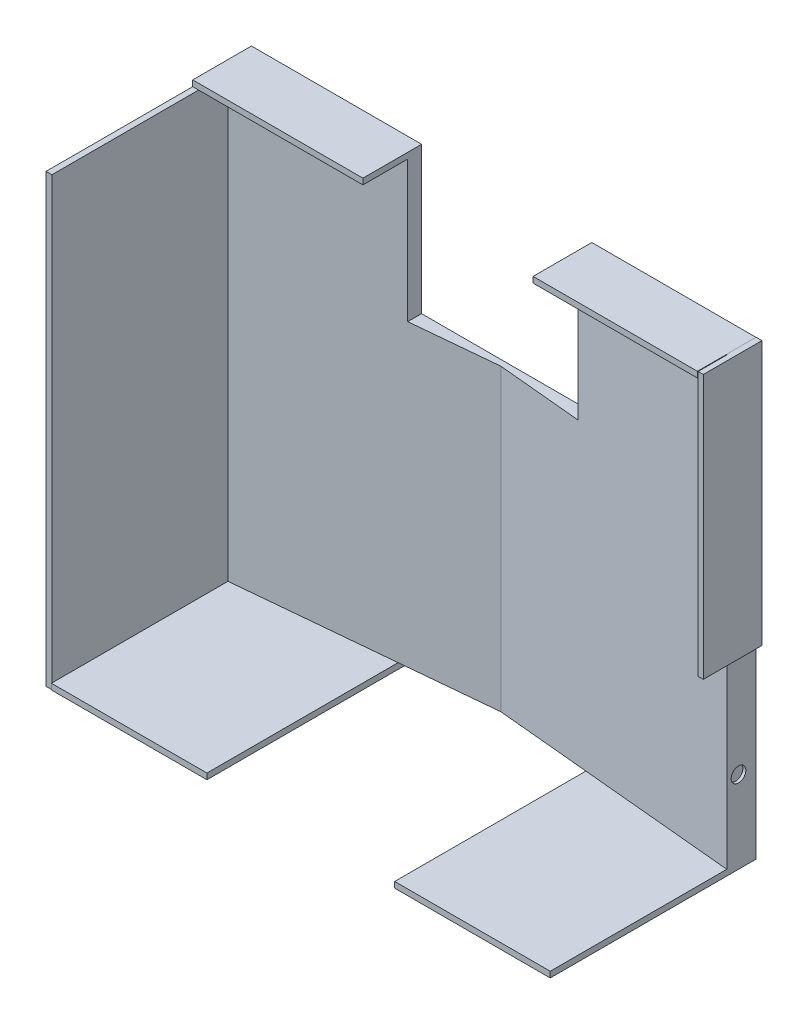
from build123d import *

# Parameters (mm, degrees)
BOSS_EXTRU_1_DEPTH       = 10
ENL_V_MAT_EXTRU_1_DEPTH  = 173.699160392
ESQUISSE6_W              = 170
ESQUISSE6_H              = 20.167534305
BOSS_EXTRU_2_DEPTH       = 2
ESQUISSE8_W              = 185.001498893
ESQUISSE8_H              = 2
BOSS_EXTRU_3_DEPTH       = 50
ESQUISSE9_W              = 70
ESQUISSE9_H              = 152
BOSS_EXTRU_4_DEPTH       = 2
ESQUISSE10_W             = 69.947510153
ESQUISSE10_H             = 152
BOSS_EXTRU_5_DEPTH       = 2
ESQUISSE11_W             = 58
ESQUISSE11_H             = 20
BOSS_EXTRU_6_DEPTH       = 2
ESQUISSE19_W             = 64
ESQUISSE19_H             = 70.167534305
ENL_V_MAT_EXTRU_9_DEPTH  = 2
ESQUISSE24_R             = 2.5
ENL_V_MAT_EXTRU_10_DEPTH = 3
ENL_V_MAT_EXTRU_11_DEPTH = 3
ESQUISSE27_W             = 13.001498893
ESQUISSE27_H             = 50.044295801
ENL_V_MAT_EXTRU_12_DEPTH = 196.007134873
ESQUISSE28_W             = 70.169211379
ESQUISSE28_H             = 154
ENL_V_MAT_EXTRU_13_DEPTH = 2
ESQUISSE29_W             = 10
ESQUISSE29_H             = 90
BOSS_EXTRU_7_DEPTH       = 2
ESQUISSE30_W             = 1.763859519
ESQUISSE30_H             = 90
BOSS_EXTRU_8_DEPTH       = 10


with BuildPart() as part:
    # Esquisse1 → Boss.-Extru.1 (new body)
    with BuildSketch(Plane.XY):
        Polygon((-29, 27), (-29, 75), (-85, 75), (-85, -75), (85, -75), (85, 75), (29, 75), (29, 27), align=None)
    extrude(amount=BOSS_EXTRU_1_DEPTH)

    # Esquisse5 → Enlèv. mat.-Extru.1 (cut, through all)
    with BuildSketch(Plane.XZ.offset(75)):
        Polygon((-85, 10), (85, 10), (0, 2), align=None)
    extrude(amount=-ENL_V_MAT_EXTRU_1_DEPTH, mode=Mode.SUBTRACT)

    # Esquisse6 → Boss.-Extru.2 (add)
    with BuildSketch(Plane(origin=(0, -75, 0), x_dir=(-1, 0, 0), z_dir=(0, -1, 0))):
        with Locations((0, -10.083767153)):
            Rectangle(ESQUISSE6_W, ESQUISSE6_H)
    extrude(amount=BOSS_EXTRU_2_DEPTH)

    # Esquisse8 → Boss.-Extru.3 (add)
    with BuildSketch(Plane.XY.offset(20.167534305)):
        with Locations((7.500749447, -76)):
            Rectangle(ESQUISSE8_W, ESQUISSE8_H)
    extrude(amount=BOSS_EXTRU_3_DEPTH)

    # Esquisse9 → Boss.-Extru.4 (add)
    with BuildSketch(Plane.ZY.offset(85)):
        with Locations((35, -1)):
            Rectangle(ESQUISSE9_W, ESQUISSE9_H)
    extrude(amount=BOSS_EXTRU_4_DEPTH)

    # Esquisse10 → Boss.-Extru.5 (add)
    with BuildSketch(Plane(origin=(85, 0, 0), x_dir=(0, 0, -1), z_dir=(1, 0, 0))):
        with Locations((-34.973755077, -1)):
            Rectangle(ESQUISSE10_W, ESQUISSE10_H)
    extrude(amount=BOSS_EXTRU_5_DEPTH)

    # Esquisse11 → Boss.-Extru.6 (add)
    with BuildSketch(Plane(origin=(0, 75, 0), x_dir=(1, 0, 0), z_dir=(0, 1, 0))):
        with Locations((-58, -10)):
            Rectangle(ESQUISSE11_W, ESQUISSE11_H)
        with Locations((58, -10)):
            Rectangle(ESQUISSE11_W, ESQUISSE11_H)
    extrude(amount=BOSS_EXTRU_6_DEPTH)

    # Esquisse19 → Enlèv. mat.-Extru.9 (cut)
    with BuildSketch(Plane(origin=(0, -77, 0), x_dir=(-1, 0, 0), z_dir=(0, -1, 0))):
        with Locations((0, -35.083767153)):
            Rectangle(ESQUISSE19_W, ESQUISSE19_H)
    extrude(amount=-ENL_V_MAT_EXTRU_9_DEPTH, mode=Mode.SUBTRACT)

    # Esquisse24 → Enlèv. mat.-Extru.10 (cut)
    with BuildSketch(Plane(origin=(87, 0, 0), x_dir=(0, 0, -1), z_dir=(1, 0, 0))):
        with Locations((-6, -49)):
            Circle(ESQUISSE24_R)
    extrude(amount=-ENL_V_MAT_EXTRU_10_DEPTH, mode=Mode.SUBTRACT)

    # Esquisse25 → Enlèv. mat.-Extru.11 (cut)
    with BuildSketch(Plane.ZY.offset(87)):
        Polygon((6, -51.886751346), (8.5, -50.443375673), (8.5, -47.556624327), (6, -46.113248654), (3.5, -47.556624327), (3.5, -50.443375673), align=None)
    extrude(amount=-ENL_V_MAT_EXTRU_11_DEPTH, mode=Mode.SUBTRACT)

    # Esquisse27 → Enlèv. mat.-Extru.12 (cut, through all)
    with BuildSketch(Plane(origin=(0, -75, 0), x_dir=(1, 0, 0), z_dir=(0, 1, 0))):
        with Locations((93.500749447, -45.189682206)):
            Rectangle(ESQUISSE27_W, ESQUISSE27_H)
    extrude(amount=-ENL_V_MAT_EXTRU_12_DEPTH, mode=Mode.SUBTRACT)

    # Esquisse28 → Enlèv. mat.-Extru.13 (cut)
    with BuildSketch(Plane(origin=(87, 0, 0), x_dir=(0, 0, -1), z_dir=(1, 0, 0))):
        with Locations((-35.08460569, 0)):
            Rectangle(ESQUISSE28_W, ESQUISSE28_H)
    extrude(amount=-ENL_V_MAT_EXTRU_13_DEPTH, mode=Mode.SUBTRACT)

    # Esquisse29 → Boss.-Extru.7 (add)
    with BuildSketch(Plane(origin=(85, 0, 0), x_dir=(0, 0, -1), z_dir=(1, 0, 0))):
        with Locations((-5, 32.051779958)):
            Rectangle(ESQUISSE29_W, ESQUISSE29_H)
    extrude(amount=BOSS_EXTRU_7_DEPTH)

    # Esquisse30 → Boss.-Extru.8 (add)
    with BuildSketch(Plane.XY.offset(10)):
        with Locations((86.118070241, 32.051779958)):
            Rectangle(ESQUISSE30_W, ESQUISSE30_H)
    extrude(amount=BOSS_EXTRU_8_DEPTH)


solid = part.part
